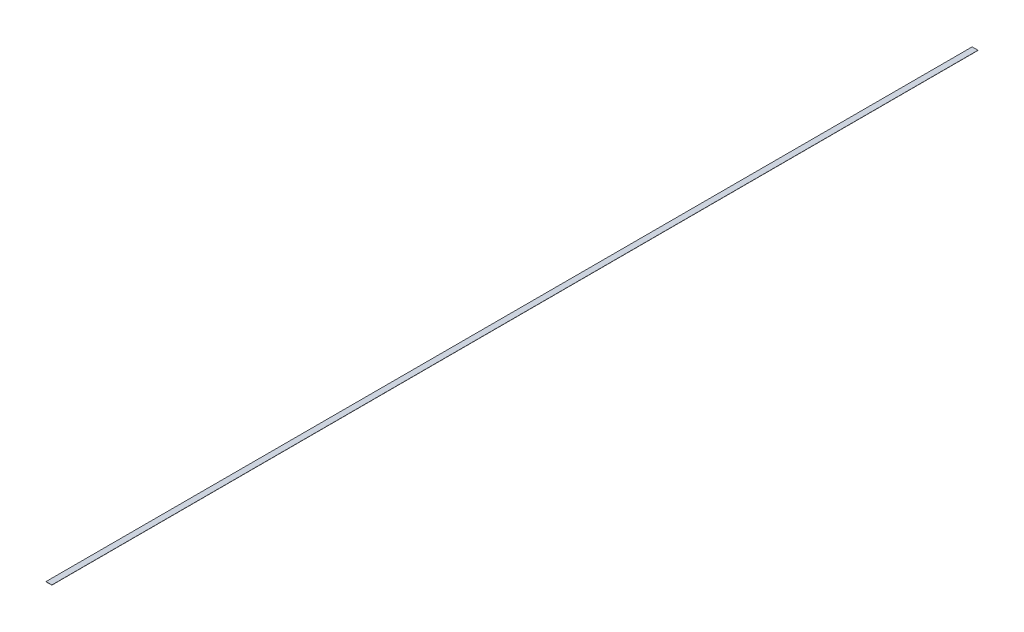
from build123d import *

# Parameters (mm, degrees)
SKETCH1_W           = 50.8
SKETCH1_H           = 8017.51
BOSS_EXTRUDE1_DEPTH = 1.5875


with BuildPart() as part:
    # Sketch1 → Boss-Extrude1 (new body)
    with BuildSketch(Plane(origin=(0, 0, 0), x_dir=(1, 0, 0), z_dir=(0, 1, 0))):
        Rectangle(SKETCH1_W, SKETCH1_H)
    extrude(amount=BOSS_EXTRUDE1_DEPTH)


solid = part.part
